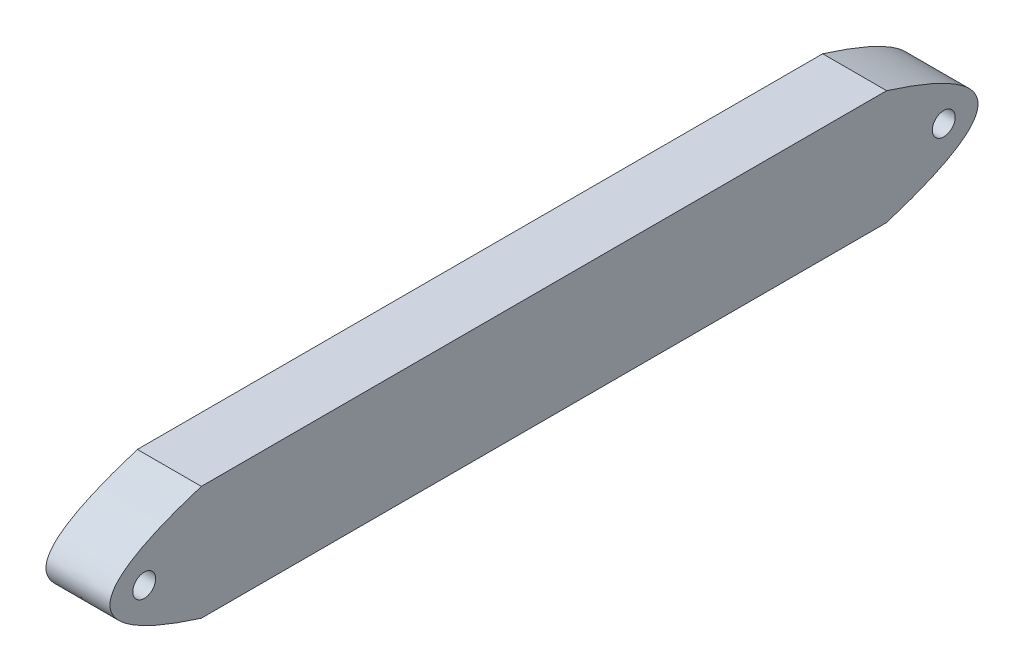
from build123d import *

# Parameters (mm, degrees)
SKETCH1_R           = 5
BOSS_EXTRUDE1_DEPTH = 28


with BuildPart() as part:
    # Sketch1 → Boss-Extrude1 (new body)
    with BuildSketch(Plane(origin=(0, 0, 0), x_dir=(0, 0, -1), z_dir=(1, 0, 0))):
        with BuildLine():
            Line((-150, 25), (150, 25))
            add(Edge.make_bspline(
                [(150, 25), (230, 0), (150, -25)],
                knots=[0, 0, 0, 1, 1, 1], degree=2))
            Line((150, -25), (-150, -25))
            add(Edge.make_bspline(
                [(-150, 25), (-230, 0), (-150, -25)],
                knots=[0, 0, 0, 1, 1, 1], degree=2))
        make_face()
        with Locations((-175, 0)):
            Circle(SKETCH1_R, mode=Mode.SUBTRACT)
        with Locations((175, 0)):
            Circle(SKETCH1_R, mode=Mode.SUBTRACT)
    extrude(amount=BOSS_EXTRUDE1_DEPTH)


solid = part.part
